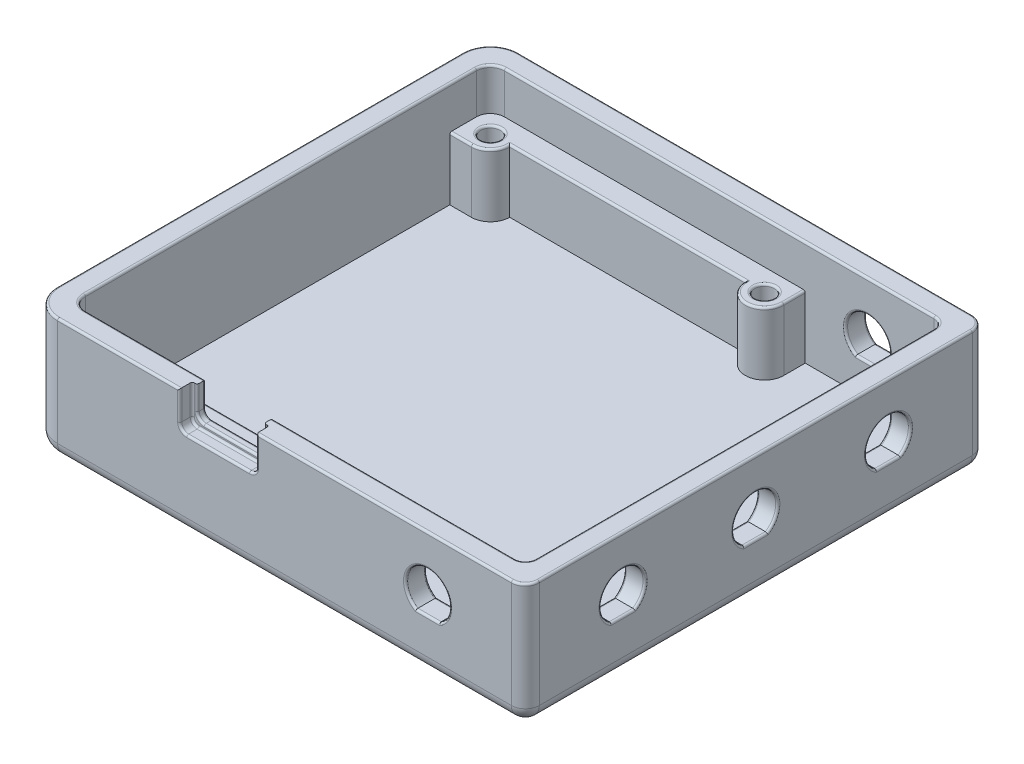
from build123d import *

# Parameters (mm, degrees)
SKETCH1_W           = 71
SKETCH1_H           = 66
SKETCH1_W_2         = 65
SKETCH1_H_2         = 60
BOSS_EXTRUDE1_DEPTH = 15
SKETCH4_W           = 71
SKETCH4_H           = 66
BOSS_EXTRUDE3_DEPTH = 2.5
SKETCH5_R           = 1.4
BOSS_EXTRUDE4_DEPTH = 9
FILLET1_R           = 2
FILLET2_R           = 4
FILLET3_R           = 2
SKETCH6_W           = 9.6
SKETCH6_H           = 8.232644003
CUT_EXTRUDE1_DEPTH  = 4.45
FILLET4_R           = 1
SKETCH7_W           = 11
SKETCH7_H           = 7
CUT_EXTRUDE2_DEPTH  = 1.8
FILLET5_R           = 1
CUT_EXTRUDE3_REACH  = 81.718
CUT_EXTRUDE4_DEPTH  = 77.428070759
FILLET6_R           = 0.3
FILLET7_R           = 1.5
FILLET8_R           = 0.3
FILLET9_R           = 0.3


with BuildPart() as part:
    # Sketch1 → Boss-Extrude1 (new body)
    with BuildSketch(Plane(origin=(0, 0, 0), x_dir=(1, 0, 0), z_dir=(0, 1, 0))):
        Rectangle(SKETCH1_W, SKETCH1_H)
        Rectangle(SKETCH1_W_2, SKETCH1_H_2, mode=Mode.SUBTRACT)
    extrude(amount=BOSS_EXTRUDE1_DEPTH)

    # Sketch4 → Boss-Extrude3 (add)
    with BuildSketch(Plane.XZ):
        Rectangle(SKETCH4_W, SKETCH4_H)
    extrude(amount=BOSS_EXTRUDE3_DEPTH)

    # Sketch5 → Boss-Extrude4 (add)
    # profile 1 of 2: a face of its own
    with BuildSketch(Plane(origin=(0, 0, 0), x_dir=(1, 0, 0), z_dir=(0, 1, 0))):
        with BuildLine():
            Line((-26.67, -26.925), (7.081, -26.925))
            ThreePointArc((7.081, -26.925), (9.831, -24.175), (12.581, -26.925))
            Line((12.581, -26.925), (12.581, -30))
            Line((12.581, -30), (-32.5, -30))
            Line((-32.5, -30), (-32.5, -24.175))
            Line((-32.5, -24.175), (-29.42, -24.175))
            ThreePointArc((-29.42, -24.175), (-27.475456352, -24.980456352), (-26.67, -26.925))
        make_face()
        with Locations(Location((9.831, -26.925, 0), (0, 0, 270))):
            Circle(SKETCH5_R, mode=Mode.SUBTRACT)
        with Locations(Location((-29.42, -26.925, 0), (0, 0, 270))):
            Circle(SKETCH5_R, mode=Mode.SUBTRACT)
    # profile 2 of 2: a face of its own
    with BuildSketch(Plane(origin=(0, 0, 0), x_dir=(1, 0, 0), z_dir=(0, 1, 0))):
        with BuildLine():
            Line((-26.67, 26.925), (7.081, 26.925))
            ThreePointArc((7.081, 26.925), (9.831, 24.175), (12.581, 26.925))
            Line((12.581, 26.925), (12.581, 30))
            Line((12.581, 30), (-32.5, 30))
            Line((-32.5, 30), (-32.5, 24.175))
            Line((-32.5, 24.175), (-29.42, 24.175))
            ThreePointArc((-29.42, 24.175), (-27.475456352, 24.980456352), (-26.67, 26.925))
        make_face()
        with Locations(Location((-29.42, 26.925, 0), (0, 0, 270))):
            Circle(SKETCH5_R, mode=Mode.SUBTRACT)
        with Locations(Location((9.831, 26.925, 0), (0, 0, 270))):
            Circle(SKETCH5_R, mode=Mode.SUBTRACT)
    extrude(amount=BOSS_EXTRUDE4_DEPTH)

    # Fillet1
    fillet1_edges = [part.edges().sort_by_distance(p)[0] for p in [
        (-32.5, 12, -30),
        (-32.5, 12, 30),
    ]]
    fillet(fillet1_edges, radius=FILLET1_R)

    # Fillet2
    fillet2_edges = [part.edges().sort_by_distance(p)[0] for p in [
        (-35.5, 6.25, 33),
        (-35.5, 6.25, -33),
    ]]
    fillet(fillet2_edges, radius=FILLET2_R)

    # Fillet3
    fillet3_edges = [part.edges().sort_by_distance(p)[0] for p in [
        (-35.5, -2.5, 0),
        (2, -2.5, -33),
        (-34.328427125, -2.5, 31.828427125),
        (-34.328427125, -2.5, -31.828427125),
        (35.5, -2.5, 0),
        (2, -2.5, 33),
        (35.5, 6.25, 33),
        (35.5, 6.25, -33),
    ]]
    fillet(fillet3_edges, radius=FILLET3_R)

    # Sketch6 → Cut-Extrude1 (cut)
    with BuildSketch(Plane(origin=(0, 15, 0), x_dir=(1, 0, 0), z_dir=(0, 1, 0))):
        with Locations((-8.5, -31.835603711)):
            Rectangle(SKETCH6_W, SKETCH6_H)
    extrude(amount=-CUT_EXTRUDE1_DEPTH, mode=Mode.SUBTRACT)

    # Fillet4
    fillet4_edges = [part.edges().sort_by_distance(p)[0] for p in [
        (-13.3, 10.55, 31.5),
        (-3.7, 10.55, 31.5),
    ]]
    fillet(fillet4_edges, radius=FILLET4_R)

    # Sketch7 → Cut-Extrude2 (cut)
    with BuildSketch(Plane.XY.offset(33)):
        with Locations((-8.5, 13.275)):
            Rectangle(SKETCH7_W, SKETCH7_H)
    extrude(amount=-CUT_EXTRUDE2_DEPTH, mode=Mode.SUBTRACT)

    # Fillet5
    fillet5_edges = [part.edges().sort_by_distance(p)[0] for p in [
        (-3, 9.775, 32.1),
        (-14, 9.775, 32.1),
    ]]
    fillet(fillet5_edges, radius=FILLET5_R)

    # Sketch8 → Cut-Extrude3 (cut, up to next)
    with BuildSketch(Plane(origin=(35.5, 0, 0), x_dir=(0, 0, -1), z_dir=(1, 0, 0)), mode=Mode.PRIVATE) as cut_extrude3_sk1:
        with BuildLine():
            Line((-20.671406593, 4.58), (-17.328593407, 4.58))
            ThreePointArc((-17.328593407, 4.58), (-19, 10.4), (-20.671406593, 4.58))
        make_face()
    cut_extrude3_tool1 = extrude(cut_extrude3_sk1.sketch, amount=-CUT_EXTRUDE3_REACH, mode=Mode.PRIVATE) & part.part
    # Sketch8 → Cut-Extrude3 (cut, up to next)
    with BuildSketch(Plane(origin=(35.5, 0, 0), x_dir=(0, 0, -1), z_dir=(1, 0, 0)), mode=Mode.PRIVATE) as cut_extrude3_sk2:
        with BuildLine():
            Line((-1.671406593, 4.58), (1.671406593, 4.58))
            ThreePointArc((1.671406593, 4.58), (0, 10.4), (-1.671406593, 4.58))
        make_face()
    cut_extrude3_tool2 = extrude(cut_extrude3_sk2.sketch, amount=-CUT_EXTRUDE3_REACH, mode=Mode.PRIVATE) & part.part
    # Sketch8 → Cut-Extrude3 (cut, up to next)
    with BuildSketch(Plane(origin=(35.5, 0, 0), x_dir=(0, 0, -1), z_dir=(1, 0, 0)), mode=Mode.PRIVATE) as cut_extrude3_sk3:
        with BuildLine():
            Line((17.328593407, 4.58), (20.671406593, 4.58))
            ThreePointArc((20.671406593, 4.58), (19, 10.4), (17.328593407, 4.58))
        make_face()
    cut_extrude3_tool3 = extrude(cut_extrude3_sk3.sketch, amount=-CUT_EXTRUDE3_REACH, mode=Mode.PRIVATE) & part.part
    add(cut_extrude3_tool1.solids().sort_by_distance((35.5, 7.353467, 19))[0], mode=Mode.SUBTRACT)
    add(cut_extrude3_tool2.solids().sort_by_distance((35.5, 7.353467, 0))[0], mode=Mode.SUBTRACT)
    add(cut_extrude3_tool3.solids().sort_by_distance((35.5, 7.353467, -19))[0], mode=Mode.SUBTRACT)

    # Sketch9 → Cut-Extrude4 (cut, through all)
    with BuildSketch(Plane.XY.offset(33)):
        with BuildLine():
            ThreePointArc((23.171406593, 4.58), (21.5, 10.4), (19.828593407, 4.58))
            Line((19.828593407, 4.58), (23.171406593, 4.58))
        make_face()
    extrude(amount=-CUT_EXTRUDE4_DEPTH, mode=Mode.SUBTRACT)

    # Fillet6
    fillet6_edges = [part.edges().sort_by_distance(p)[0] for p in [
        (-35.5, 15, 0),
        (-22.75, 15, 33),
        (-34.328427125, 15, 31.828427125),
        (-34.328427125, 15, -31.828427125),
        (35.5, 15, 0),
        (1, 15, -33),
        (34.914213562, 15, -32.414213562),
        (34.914213562, 15, 32.414213562),
        (-13.007106781, 10.842893219, 31.2),
        (15.25, 15, 33),
        (-3.7, 13.275, 31.2),
        (-3.992893219, 10.842893219, 31.2),
        (-13.3, 13.275, 31.2),
        (-14, 12.8875, 31.2),
        (-8.5, 10.55, 31.2),
        (-14, 12.8875, 33),
        (-3, 12.8875, 31.2),
        (-3, 12.8875, 33),
        (-8.5, 9.775, 33),
        (-8.5, 9.775, 31.2),
        (-13.707106781, 10.067893219, 31.2),
        (-3.292893219, 10.067893219, 31.2),
        (-3.292893219, 10.067893219, 33),
        (-13.707106781, 10.067893219, 33),
    ]]
    fillet(fillet6_edges, radius=FILLET6_R)

    # Fillet7
    fillet7_edges = [part.edges().sort_by_distance(p)[0] for p in [
        (32.5, 7.5, 30),
        (32.5, 7.5, -30),
    ]]
    fillet(fillet7_edges, radius=FILLET7_R)

    # Fillet8
    fillet8_edges = [part.edges().sort_by_distance(p)[0] for p in [
        (-21.9, 15, 30),
        (-31.914213562, 15, 29.414213562),
        (-31.914213562, 15, -29.414213562),
        (13.65, 15, 30),
        (-3.7, 13.275, 30),
        (-8.5, 10.55, 30),
        (-13.3, 13.275, 30),
        (-3.992893219, 10.842893219, 30),
        (-13.007106781, 10.842893219, 30),
        (32.5, 15, 0),
        (0.25, 15, -30),
        (32.060660172, 15, 29.560660172),
        (32.060660172, 15, -29.560660172),
        (-32.5, 15, 0),
    ]]
    fillet(fillet8_edges, radius=FILLET8_R)

    # Fillet9
    fillet9_edges = [part.edges().sort_by_distance(p)[0] for p in [
        (32.5, 10.4, -19),
        (32.5, 4.58, -19),
        (35.5, 10.4, -19),
        (35.5, 4.58, -19),
        (32.5, 10.4, 0),
        (32.5, 4.58, 0),
        (35.5, 10.4, 0),
        (35.5, 4.58, 0),
        (32.5, 10.4, 19),
        (32.5, 4.58, 19),
        (35.5, 10.4, 19),
        (35.5, 4.58, 19),
        (21.5, 10.4, 30),
        (21.5, 4.58, 30),
        (21.5, 4.58, -30),
        (21.5, 4.58, -33),
        (21.5, 10.4, -30),
        (21.5, 10.4, -33),
        (21.5, 4.58, 33),
        (21.5, 10.4, 33),
        (-27.475456352, 9, -24.980456352),
        (-9.7945, 9, -26.925),
        (9.831, 9, -24.175),
        (12.581, 9, -28.4625),
        (-30.96, 9, -24.175),
        (-29.42, 9, -28.325),
        (9.831, 9, -28.325),
        (-27.475456352, 9, 24.980456352),
        (-30.96, 9, 24.175),
        (12.581, 9, 28.4625),
        (9.831, 9, 24.175),
        (-9.7945, 9, 26.925),
        (9.831, 9, 25.525),
        (-29.42, 9, 25.525),
    ]]
    fillet(fillet9_edges, radius=FILLET9_R)


solid = part.part
